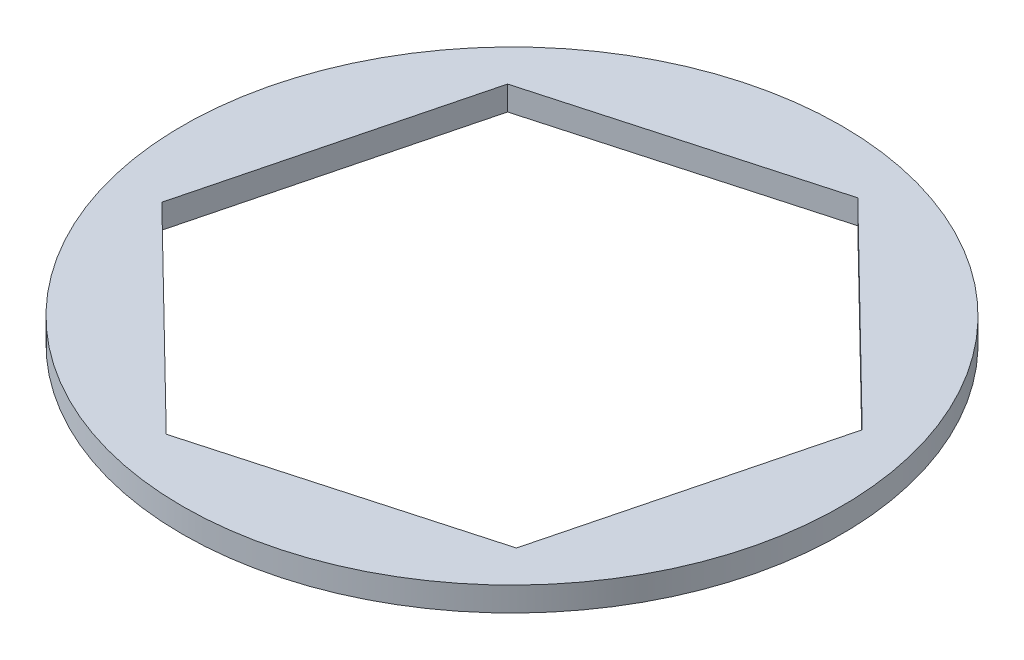
from build123d import *

# Parameters (mm, degrees)
SKETCH1_R           = 9.525
BOSS_EXTRUDE1_DEPTH = 0.7


with BuildPart() as part:
    # Sketch1 → Boss-Extrude1 (new body)
    with BuildSketch(Plane(origin=(0, 0, 0), x_dir=(1, 0, 0), z_dir=(0, 1, 0))):
        with Locations(Location((0, 0, 0), (0, 0, 270))):
            Circle(SKETCH1_R)
        Polygon((2.038133716, 7.955296116), (-5.870421673, 5.742723632), (-7.908555389, -2.212572484), (-2.038133716, -7.955296116), (5.870421673, -5.742723632), (7.908555389, 2.212572484), align=None, mode=Mode.SUBTRACT)
    extrude(amount=BOSS_EXTRUDE1_DEPTH)


solid = part.part
